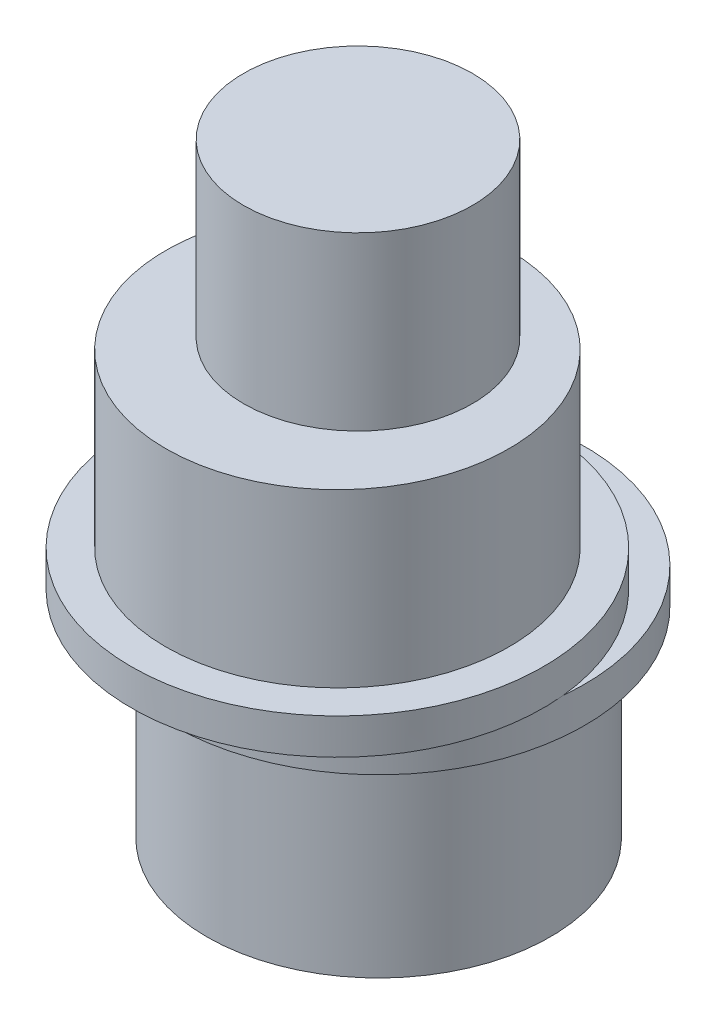
from build123d import *

# Parameters (mm, degrees)
SKETCH1_R               = 6
BOSS_EXTRUDE1_DEPTH     = 7
SKETCH2_R               = 7.2
BOSS_EXTRUDE2_DEPTH     = 1.25
SKETCH3_R               = 7.2
BOSS_EXTRUDE3_DEPTH     = 1.25
SKETCH4_R               = 6
BOSS_EXTRUDE4_DEPTH     = 6
CUT_EXTRUDE2_DEPTH      = 19.836570813
CUT_EXTRUDE2_DEPTH_BACK = 11
SKETCH6_R               = 4
BOSS_EXTRUDE5_DEPTH     = 6


with BuildPart() as part:
    # Sketch1 → Boss-Extrude1 (new body)
    with BuildSketch(Plane(origin=(0, 0, 0), x_dir=(1, 0, 0), z_dir=(0, 1, 0))):
        with Locations(Location((0, 0.72, 0), (0, 0, 270))):
            Circle(SKETCH1_R)
    extrude(amount=BOSS_EXTRUDE1_DEPTH)

    # Sketch2 → Boss-Extrude2 (add)
    with BuildSketch(Plane(origin=(0, 7, 0), x_dir=(1, 0, 0), z_dir=(0, 1, 0))):
        with Locations(Location((0, 0.72, 0), (0, 0, 270))):
            Circle(SKETCH2_R)
    extrude(amount=BOSS_EXTRUDE2_DEPTH)

    # Sketch3 → Boss-Extrude3 (add)
    with BuildSketch(Plane(origin=(0, 8.25, 0), x_dir=(1, 0, 0), z_dir=(0, 1, 0))):
        with Locations(Location((0, -0.72, 0), (0, 0, 174.260829523))):
            Circle(SKETCH3_R)
    extrude(amount=BOSS_EXTRUDE3_DEPTH)

    # Sketch4 → Boss-Extrude4 (add)
    with BuildSketch(Plane(origin=(0, 9.5, 0), x_dir=(1, 0, 0), z_dir=(0, 1, 0))):
        with Locations(Location((0, -0.72, 0), (0, 0, 270))):
            Circle(SKETCH4_R)
    extrude(amount=BOSS_EXTRUDE4_DEPTH)

    # Sketch5 → Cut-Extrude2 (cut, two sides: drawn at the far end of the back side and taken through both)
    with BuildSketch(Plane.XZ.offset(-CUT_EXTRUDE2_DEPTH_BACK)):
        with BuildLine():
            Line((1.5, 2), (-1.5, 2))
            ThreePointArc((-1.5, 2), (0, -2.5), (1.5, 2))
        make_face()
    extrude(amount=CUT_EXTRUDE2_DEPTH + CUT_EXTRUDE2_DEPTH_BACK, mode=Mode.SUBTRACT)

    # Sketch6 → Boss-Extrude5 (add)
    with BuildSketch(Plane(origin=(0, 15.5, 0), x_dir=(1, 0, 0), z_dir=(0, 1, 0))):
        with Locations(Location((0, 0, 0), (0, 0, 270))):
            Circle(SKETCH6_R)
    extrude(amount=BOSS_EXTRUDE5_DEPTH)


solid = part.part
